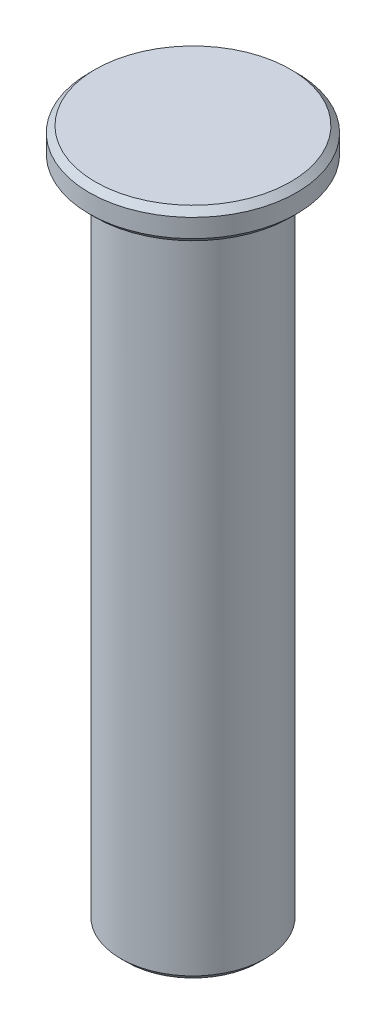
from build123d import *

# Parameters (mm, degrees)
SKETCH1_R           = 4.7
BOSS_EXTRUDE1_DEPTH = 45
SKETCH2_R           = 6.75
BOSS_EXTRUDE2_DEPTH = 2
CHAMFER1_SIZE       = 0.4


with BuildPart() as part:
    # Sketch1 → Boss-Extrude1 (new body)
    with BuildSketch(Plane(origin=(0, 0, 0), x_dir=(1, 0, 0), z_dir=(0, 1, 0))):
        with Locations(Location((0, 0, 0), (0, 0, 90))):
            Circle(SKETCH1_R)
    extrude(amount=BOSS_EXTRUDE1_DEPTH)

    # Sketch2 → Boss-Extrude2 (add)
    with BuildSketch(Plane(origin=(0, 45, 0), x_dir=(1, 0, 0), z_dir=(0, 1, 0))):
        with Locations(Location((0, 0, 0), (0, 0, 270))):
            Circle(SKETCH2_R)
    extrude(amount=-BOSS_EXTRUDE2_DEPTH)

    # Chamfer1
    chamfer1_edges = [part.edges().sort_by_distance(p)[0] for p in [
        (0, 0, 4.7),
        (0, 43, -6.75),
        (0, 45, -6.75),
    ]]
    chamfer(chamfer1_edges, length=CHAMFER1_SIZE)


solid = part.part
